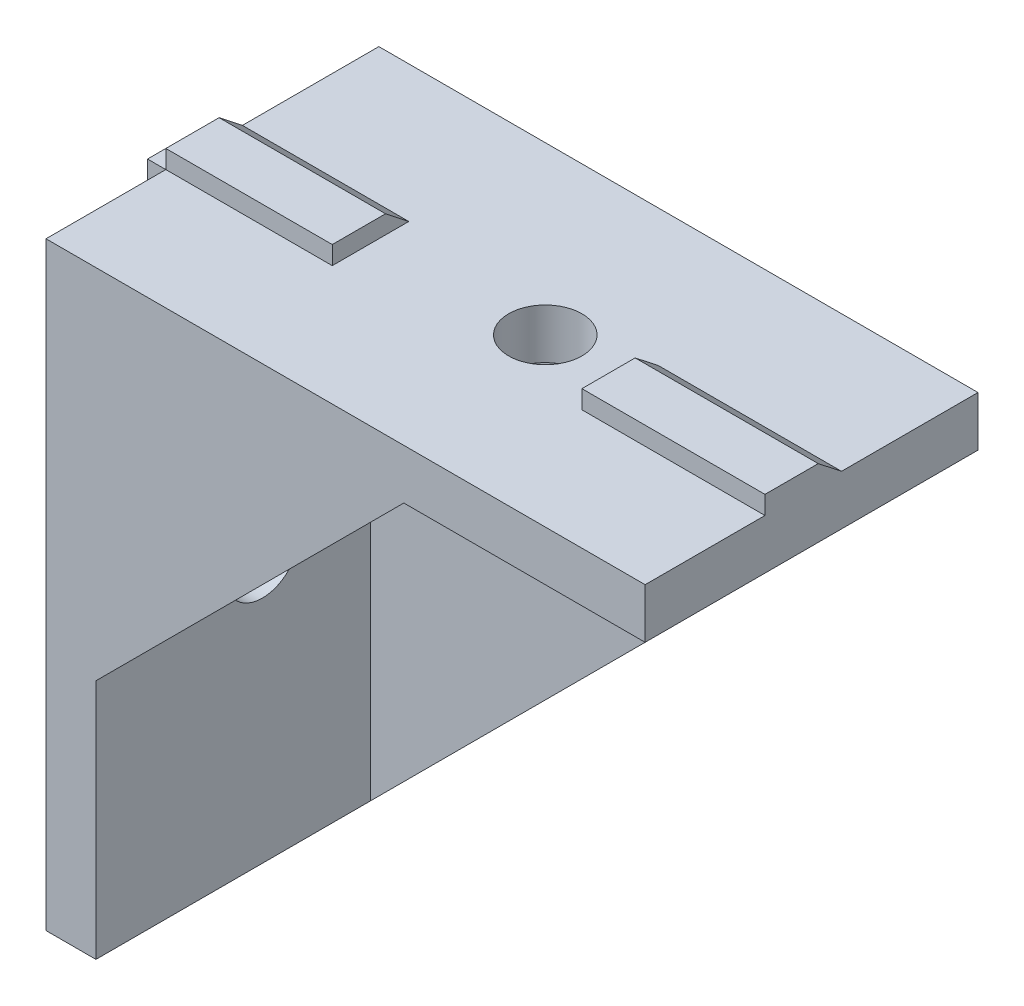
from build123d import *

# Parameters (mm, degrees)
BOSS_EXTRUDE1_DEPTH = 3.5
BOSS_EXTRUDE2_DEPTH = 16.5
BOSS_EXTRUDE3_DEPTH = 2.5
SKETCH4_R           = 2.2
CUT_EXTRUDE1_DEPTH  = 53.773099208
SKETCH5_R           = 2.2
CUT_EXTRUDE2_DEPTH  = 53.773099208
BOSS_EXTRUDE5_DEPTH = 36
SKETCH7_W           = 15
SKETCH7_H           = 1.1
CUT_EXTRUDE3_DEPTH  = 53.496095093
BOSS_EXTRUDE6_REACH = 57.429
SKETCH9_W           = 1.1
SKETCH9_H           = 15
CUT_EXTRUDE4_DEPTH  = 53.496095093
BOSS_EXTRUDE7_START = -12.383093
BOSS_EXTRUDE7_DEPTH = 12.383093
CUT_EXTRUDE5_DEPTH  = 60.161910074
CUT_EXTRUDE6_DEPTH  = 55.699177325


with BuildPart() as part:
    # Sketch1 → Boss-Extrude1 (new body)
    with BuildSketch(Plane.XY):
        Polygon((0, -36), (0, 0), (36, 0), (36, -3), (3, -36), align=None)
    extrude(amount=BOSS_EXTRUDE1_DEPTH)

    # Sketch2 → Boss-Extrude2 (add)
    with BuildSketch(Plane.XY.offset(3.5)):
        Polygon((0, -36), (0, 0), (36, 0), (36, -3), (3, -3), (3, -36), align=None)
    extrude(amount=BOSS_EXTRUDE2_DEPTH)

    # Sketch3 → Boss-Extrude3 (add)
    with BuildSketch(Plane.XY.offset(20)):
        Polygon((3, -21.5), (21.5, -3), (3, -3), align=None)
    extrude(amount=-BOSS_EXTRUDE3_DEPTH)

    # Sketch4 → Cut-Extrude1 (cut, through all)
    with BuildSketch(Plane.XZ.offset(3)):
        with Locations(Location((20, 10, 0), (0, 0, 270))):
            Circle(SKETCH4_R)
    extrude(amount=-CUT_EXTRUDE1_DEPTH, mode=Mode.SUBTRACT)

    # Sketch5 → Cut-Extrude2 (cut, through all)
    with BuildSketch(Plane(origin=(3, 0, 0), x_dir=(0, 0, -1), z_dir=(1, 0, 0))):
        with Locations((-10, -20)):
            Circle(SKETCH5_R)
    extrude(amount=-CUT_EXTRUDE2_DEPTH, mode=Mode.SUBTRACT)

    # Sketch6 → Boss-Extrude5 (add, through all)
    with BuildSketch(Plane(origin=(36, 0, 0), x_dir=(0, 0, -1), z_dir=(1, 0, 0))):
        Polygon((-12.8, 0), (-12.8, 1.1), (-9.6, 1.1), (-8.2, 0), align=None)
    extrude(amount=-BOSS_EXTRUDE5_DEPTH)

    # Sketch7 → Cut-Extrude3 (cut, through all)
    with BuildSketch(Plane.XY.offset(12.8)):
        with Locations((17.5, 0.55)):
            Rectangle(SKETCH7_W, SKETCH7_H)
    extrude(amount=-CUT_EXTRUDE3_DEPTH, mode=Mode.SUBTRACT)

    # Boss-Extrude6: up to this face of the body (flat: up to its plane)
    boss_extrude6_end = Plane(part.part.faces().sort_by_distance((0.411825206, 0, 16.4))[0])
    # Sketch8 → Boss-Extrude6 (add, up to the picked face)
    with BuildSketch(Plane.XZ.offset(36), mode=Mode.PRIVATE) as boss_extrude6_sk1:
        Polygon((0, 8.2), (0, 12.8), (-1.1, 12.8), (-1.1, 9.6), align=None)
    boss_extrude6_tool1 = split(extrude(boss_extrude6_sk1.sketch, amount=-BOSS_EXTRUDE6_REACH, mode=Mode.PRIVATE), bisect_by=boss_extrude6_end, keep=Keep.BOTH, mode=Mode.PRIVATE)
    add(boss_extrude6_tool1.solids().sort_by(Axis((-0.517094, -36, 10.82906), (0, 1, 0)))[0])

    # Sketch9 → Cut-Extrude4 (cut, through all)
    with BuildSketch(Plane.XY.offset(12.8)):
        with Locations((-0.55, -17.5)):
            Rectangle(SKETCH9_W, SKETCH9_H)
    extrude(amount=-CUT_EXTRUDE4_DEPTH, mode=Mode.SUBTRACT)

    # Sketch11 → Boss-Extrude7 (add)
    with BuildSketch(Plane(origin=(-2.016949153, 2.016949153, 4.389830508), x_dir=(-0.9228036153935797, -0.16085056987258428, -0.35008653442856574), z_dir=(0.3852706677344363, -0.38527066773443636, -0.8385302768337725)).offset(BOSS_EXTRUDE7_START)):
        Polygon((-25.484240374, -10.032283534), (-5.436637946, -26.842805147), (-5.436637946, -6.483532076), align=None)
    extrude(amount=BOSS_EXTRUDE7_DEPTH)

    # Sketch12 → Cut-Extrude5 (cut, through all)
    with BuildSketch(Plane(origin=(36, 0, 0), x_dir=(0, 0, -1), z_dir=(1, 0, 0))):
        Polygon((-20, 0), (-20, -21.5), (-27.88359819, -21.5), (-27.88359819, 1.770842411), (-14.747015728, 1.770842411), (-14.747015728, 0), align=None)
    extrude(amount=-CUT_EXTRUDE5_DEPTH, mode=Mode.SUBTRACT)

    # Sketch13 → Cut-Extrude6 (cut, through all)
    with BuildSketch(Plane(origin=(0, 0, 0), x_dir=(1, 0, 0), z_dir=(0, 1, 0))):
        Polygon((0, -15.529411765), (0, -20), (-1.6960193, -20), align=None)
    extrude(amount=-CUT_EXTRUDE6_DEPTH, mode=Mode.SUBTRACT)


solid = part.part
